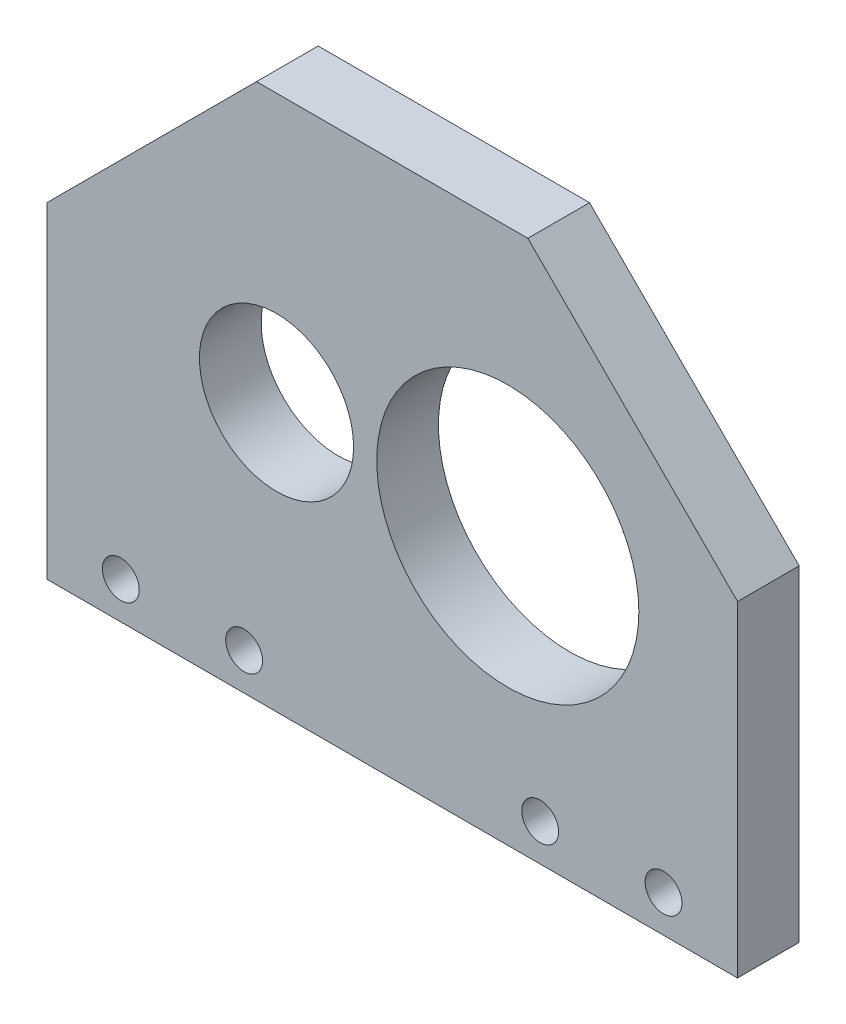
from build123d import *

# Parameters (mm, degrees)
SKETCH1_W             = 71.12
SKETCH1_H             = 55.16372
SKETCH1_R             = 13.49375
SKETCH1_R_2           = 7.9375
BOSS_EXTRUDE1_DEPTH   = 6.35
F_6_CLEARANCE_HOLE1_D = 3.7973
CUT_EXTRUDE1_DEPTH    = 46.448818478


with BuildPart() as part:
    # Sketch1 → Boss-Extrude1 (new body)
    with BuildSketch(Plane.XY):
        Rectangle(SKETCH1_W, SKETCH1_H)
        with Locations((11.90625, 0)):
            Circle(SKETCH1_R, mode=Mode.SUBTRACT)
        with Locations((-11.90625, 0)):
            Circle(SKETCH1_R_2, mode=Mode.SUBTRACT)
    extrude(amount=BOSS_EXTRUDE1_DEPTH)

    # #6 Clearance Hole1 (through all)
    with Locations(Plane.XY.offset(6.35)):
        with Locations((-27.94, -23.77186), (-15.24, -23.77186), (15.24, -23.77186), (27.94, -23.77186)):
            Hole(F_6_CLEARANCE_HOLE1_D / 2)

    # Sketch4 → Cut-Extrude1 (cut, through all)
    with BuildSketch(Plane.XY.offset(6.35)):
        Polygon((-35.56, 5.99186), (-13.97, 27.58186), (-35.56, 27.58186), align=None)
        Polygon((35.56, 5.99186), (13.97, 27.58186), (35.56, 27.58186), align=None)
    extrude(amount=-CUT_EXTRUDE1_DEPTH, mode=Mode.SUBTRACT)


solid = part.part
